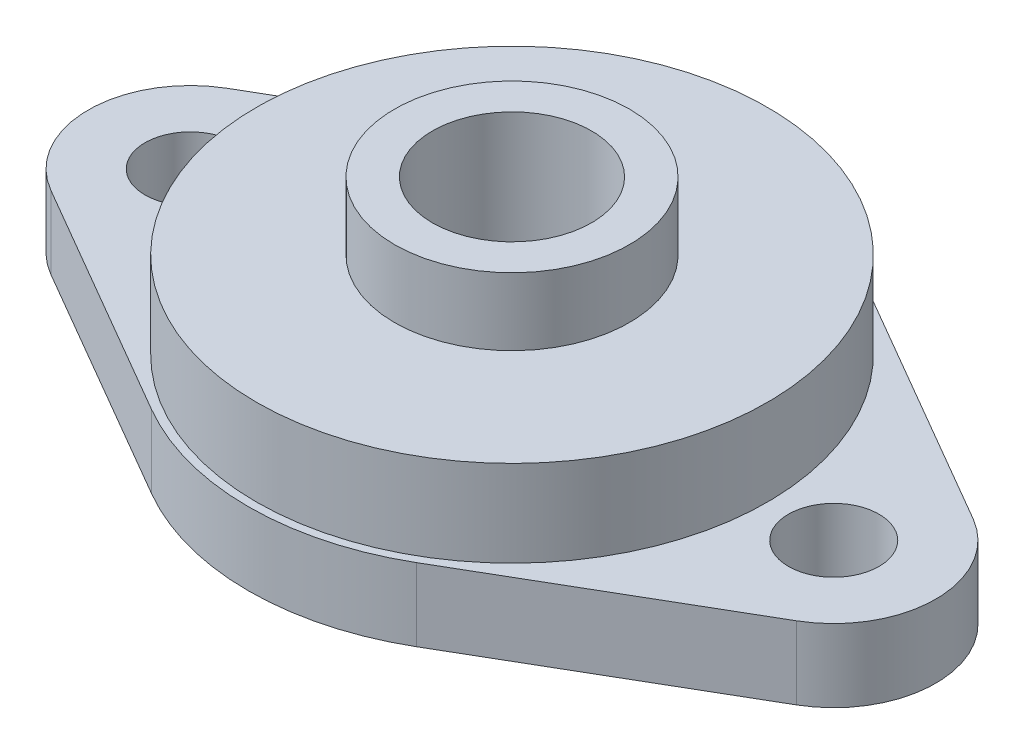
from build123d import *

# Parameters (mm, degrees)
SKETCH1_R           = 2.275
BOSS_EXTRUDE4_DEPTH = 3.66
SKETCH8_R           = 12.835
BOSS_EXTRUDE5_DEPTH = 8
SKETCH9_R           = 5.9
BOSS_EXTRUDE6_DEPTH = 11.39
SKETCH10_R          = 4
CUT_EXTRUDE3_DEPTH  = 28.533269421


with BuildPart() as part:
    # Sketch1 → Boss-Extrude4 (new body)
    with BuildSketch(Plane(origin=(0, 0, 0), x_dir=(1, 0, 0), z_dir=(0, 1, 0))):
        with BuildLine():
            Line((-6.648675743, 11.449572519), (-18.733599938, 4.431953109))
            ThreePointArc((-18.733599938, 4.431953109), (-21.285, 0), (-18.733599938, -4.431953109))
            Line((-18.733599938, -4.431953109), (-6.648675743, -11.449572519))
            ThreePointArc((-6.648675743, -11.449572519), (-3.442764866, -12.784559831), (0, -13.24))
            Line((0, -13.24), (0, 13.24))
            ThreePointArc((0, 13.24), (-3.442764866, 12.784559831), (-6.648675743, 11.449572519))
        make_face()
        with Locations(Location((-16.16, 0, 0), (0, 0, 270))):
            Circle(SKETCH1_R, mode=Mode.SUBTRACT)
    boss_extrude4 = extrude(amount=BOSS_EXTRUDE4_DEPTH)

    # Mirror2: Boss-Extrude4 across plane
    add(boss_extrude4.mirror(Plane(origin=(0, 0, 0), x_dir=(0, 0, 1), z_dir=(1, 0, 0))))

    # Sketch8 → Boss-Extrude5 (add)
    with BuildSketch(Plane(origin=(0, 0, 0), x_dir=(1, 0, 0), z_dir=(0, 1, 0))):
        with Locations(Location((0, 0, 0), (0, 0, 270))):
            Circle(SKETCH8_R)
    extrude(amount=BOSS_EXTRUDE5_DEPTH)

    # Sketch9 → Boss-Extrude6 (add)
    with BuildSketch(Plane(origin=(0, 0, 0), x_dir=(1, 0, 0), z_dir=(0, 1, 0))):
        with Locations(Location((0, 0, 0), (0, 0, 270))):
            Circle(SKETCH9_R)
    extrude(amount=BOSS_EXTRUDE6_DEPTH)

    # Sketch10 → Cut-Extrude3 (cut, through all)
    with BuildSketch(Plane(origin=(0, 11.39, 0), x_dir=(1, 0, 0), z_dir=(0, 1, 0))):
        with Locations(Location((0, 0, 0), (0, 0, 270))):
            Circle(SKETCH10_R)
    extrude(amount=-CUT_EXTRUDE3_DEPTH, mode=Mode.SUBTRACT)


solid = part.part
